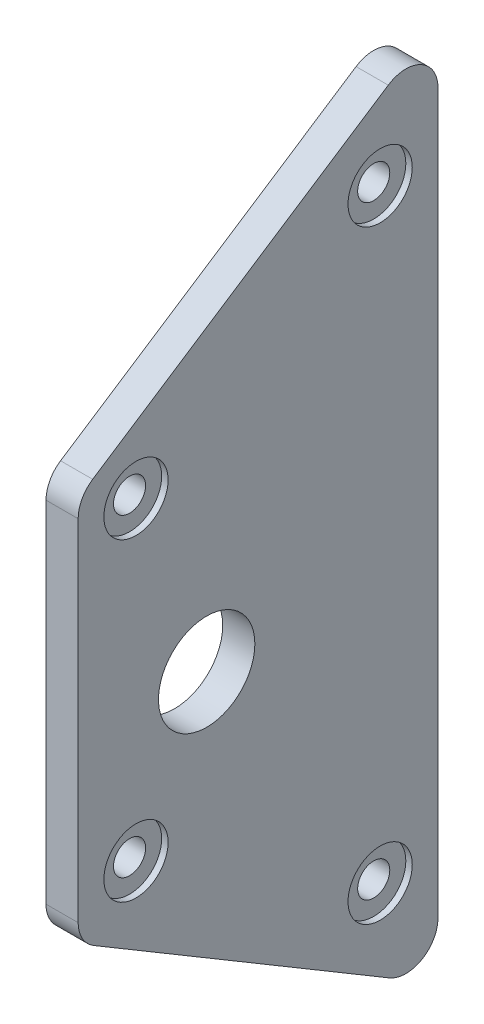
from build123d import *

# Parameters (mm, degrees)
SKETCH2_R           = 3.175
SKETCH2_R_2         = 9.525
BOSS_EXTRUDE1_DEPTH = 6.35
SKETCH3_R           = 6.35
CUT_EXTRUDE1_DEPTH  = 1.27
FILLET1_R           = 6.35


with BuildPart() as part:
    # Sketch2 → Boss-Extrude1 (new body)
    with BuildSketch(Plane(origin=(0, 0, 0), x_dir=(0, 0, -1), z_dir=(1, 0, 0))):
        Polygon((-30.570599259, 35.964413408), (-30.570599259, -40.235586592), (40.549400741, -82.55), (40.549400741, 82.55), align=None)
        with Locations((29.119400741, 59.69)):
            Circle(SKETCH2_R, mode=Mode.SUBTRACT)
        with Locations((-19.140599259, 30.292732622)):
            Circle(SKETCH2_R, mode=Mode.SUBTRACT)
        with Locations((29.119400741, -59.69)):
            Circle(SKETCH2_R, mode=Mode.SUBTRACT)
        with Locations((-19.140599259, -31.75)):
            Circle(SKETCH2_R, mode=Mode.SUBTRACT)
        with Locations((-5.170599259, -6.35)):
            Circle(SKETCH2_R_2, mode=Mode.SUBTRACT)
    extrude(amount=BOSS_EXTRUDE1_DEPTH)

    # Sketch3 → Cut-Extrude1 (cut)
    with BuildSketch(Plane(origin=(6.35, 0, 0), x_dir=(0, 0, -1), z_dir=(1, 0, 0))):
        with Locations((-19.140599259, 30.292732622)):
            Circle(SKETCH3_R)
        with Locations((29.119400741, 59.69)):
            Circle(SKETCH3_R)
        with Locations((-19.140599259, -31.75)):
            Circle(SKETCH3_R)
        with Locations((29.119400741, -59.69)):
            Circle(SKETCH3_R)
    extrude(amount=-CUT_EXTRUDE1_DEPTH, mode=Mode.SUBTRACT)

    # Fillet1
    fillet1_edges = [part.edges().sort_by_distance(p)[0] for p in [
        (3.175, 82.55, -40.549400741),
        (3.175, -82.55, -40.549400741),
        (3.175, -40.235586592, 30.570599259),
        (3.175, 35.964413408, 30.570599259),
    ]]
    fillet(fillet1_edges, radius=FILLET1_R)


solid = part.part
